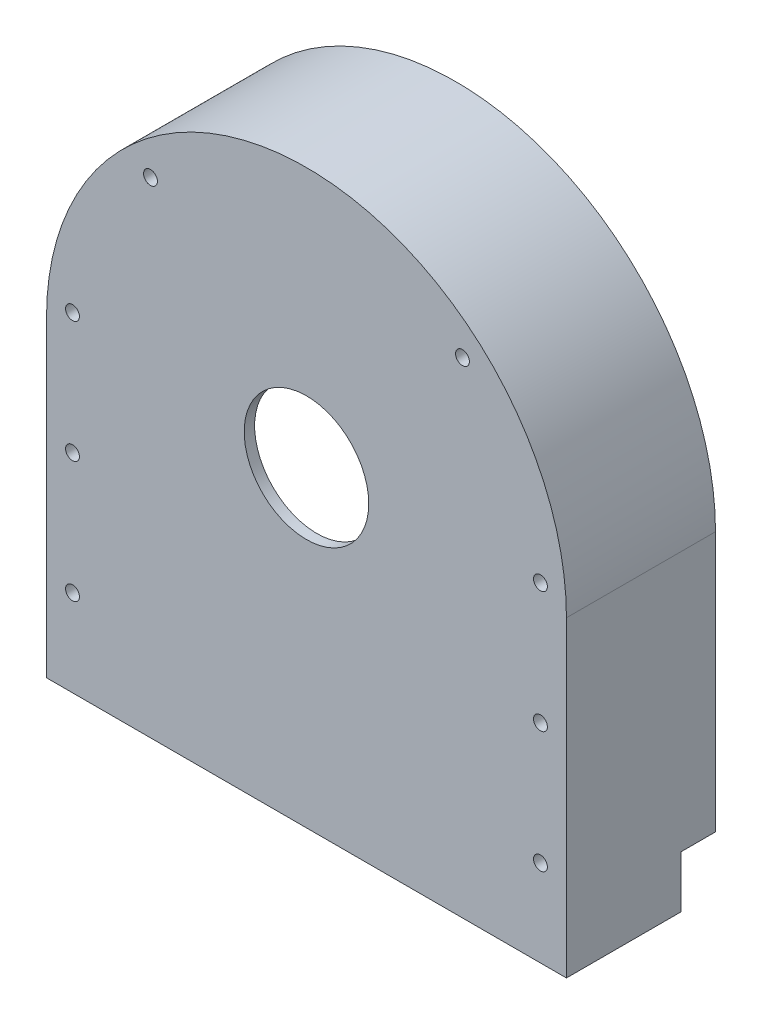
from build123d import *

# Parameters (mm, degrees)
SKETCH1_R           = 17.96
BOSS_EXTRUDE1_DEPTH = 3
SKETCH2_W           = 150
SKETCH2_H           = 15
BOSS_EXTRUDE2_DEPTH = 30
BOSS_EXTRUDE3_START = 40
BOSS_EXTRUDE3_DEPTH = 40
FILLET1_R           = 2
SKETCH4_R           = 2
CUT_EXTRUDE1_DEPTH  = 4
SKETCH6_R           = 2
BOSS_EXTRUDE4_DEPTH = 40
SKETCH7_R           = 4.76
CUT_EXTRUDE4_DEPTH  = 30
SKETCH5_R           = 2
CUT_EXTRUDE6_DEPTH  = 60


with BuildPart() as part:
    # Sketch1 → Boss-Extrude1 (new body)
    with BuildSketch(Plane.XY):
        with BuildLine():
            Line((-75, 0), (-75, -75))
            Line((-75, -75), (-75, -90))
            Line((-75, -90), (75, -90))
            Line((75, -90), (75, -75))
            Line((75, -75), (75, 0))
            ThreePointArc((75, 0), (0, 75), (-75, 0))
        make_face()
        Circle(SKETCH1_R, mode=Mode.SUBTRACT)
    extrude(amount=BOSS_EXTRUDE1_DEPTH)

    # Sketch2 → Boss-Extrude2 (add)
    with BuildSketch(Plane(origin=(0, 0, 0), x_dir=(-1, 0, 0), z_dir=(0, 0, -1))):
        with Locations((0, -82.5)):
            Rectangle(SKETCH2_W, SKETCH2_H)
    extrude(amount=BOSS_EXTRUDE2_DEPTH)

    # Sketch3 → Boss-Extrude3 (add)
    with BuildSketch(Plane(origin=(0, 0, 0), x_dir=(-1, 0, 0), z_dir=(0, 0, -1)).offset(BOSS_EXTRUDE3_START)):
        with BuildLine():
            Line((75, 0), (75, -75))
            Line((75, -75), (72, -75))
            Line((72, -75), (72, 0))
            ThreePointArc((72, 0), (0, 72), (-72, 0))
            Line((-72, 0), (-72, -75))
            Line((-72, -75), (-75, -75))
            Line((-75, -75), (-75, 0))
            ThreePointArc((-75, 0), (0, 75), (75, 0))
        make_face()
    extrude(amount=-BOSS_EXTRUDE3_DEPTH)

    # Fillet1
    fillet1_edges = [part.edges().sort_by_distance(p)[0] for p in [
        (0, -75, 0),
        (72, -37.5, 0),
        (0, 72, 0),
        (-72, -37.5, 0),
    ]]
    fillet(fillet1_edges, radius=FILLET1_R)

    # Sketch4 → Cut-Extrude1 (cut)
    with BuildSketch(Plane.XY.offset(3)):
        with Locations((-67.5, -65)):
            Circle(SKETCH4_R)
        with Locations((67.5, -65)):
            Circle(SKETCH4_R)
        with Locations((67.5, -30)):
            Circle(SKETCH4_R)
        with Locations((67.5, 5)):
            Circle(SKETCH4_R)
        with Locations((-67.5, -30)):
            Circle(SKETCH4_R)
        with Locations((-67.5, 5)):
            Circle(SKETCH4_R)
    extrude(amount=-CUT_EXTRUDE1_DEPTH, mode=Mode.SUBTRACT)

    # Sketch6 → Boss-Extrude4 (add)
    with BuildSketch(Plane(origin=(0, 0, 0), x_dir=(-1, 0, 0), z_dir=(0, 0, -1))):
        with Locations(Location((43.16, -8.11, 0), (0, 0, 180))):
            Circle(SKETCH6_R)
        with Locations(Location((33.67, 17.57, 0), (0, 0, 180))):
            Circle(SKETCH6_R)
        with Locations(Location((33.67, 39.49, 0), (0, 0, 180))):
            Circle(SKETCH6_R)
    extrude(amount=BOSS_EXTRUDE4_DEPTH)

    # Sketch7 → Cut-Extrude4 (cut)
    with BuildSketch(Plane.ZY.offset(75)):
        with Locations((-23.57, 42.71)):
            Circle(SKETCH7_R)
    extrude(amount=-CUT_EXTRUDE4_DEPTH, mode=Mode.SUBTRACT)

    # Sketch5 → Cut-Extrude6 (cut)
    with BuildSketch(Plane.XY.offset(3)):
        with Locations((-45, 50)):
            Circle(SKETCH5_R)
        with Locations((45, 50)):
            Circle(SKETCH5_R)
    extrude(amount=-CUT_EXTRUDE6_DEPTH, mode=Mode.SUBTRACT)


solid = part.part
